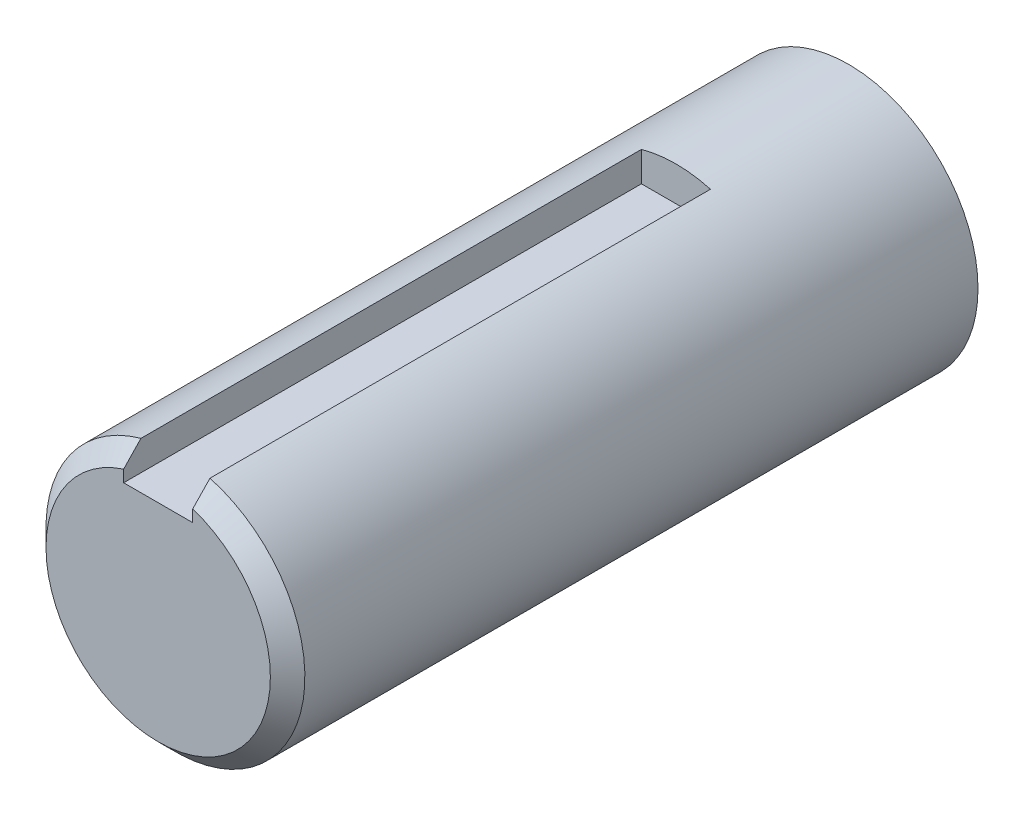
from build123d import *

# Parameters (mm, degrees)
SKETCH1_R           = 15
BOSS_EXTRUDE1_DEPTH = 40
CUT_EXTRUDE1_DEPTH  = 60
CHAMFER1_SIZE       = 2


with BuildPart() as part:
    # Sketch1 → Boss-Extrude1 (new, symmetric)
    with BuildSketch(Plane.XY):
        Circle(SKETCH1_R)
    extrude(amount=BOSS_EXTRUDE1_DEPTH, both=True)

    # Sketch2 → Cut-Extrude1 (cut)
    with BuildSketch(Plane.XY.offset(40)):
        with BuildLine():
            Line((-4, 14.456832295), (-4, 11))
            Line((-4, 11), (4, 11))
            Line((4, 11), (4, 14.456832295))
            ThreePointArc((4, 14.456832295), (0, 15), (-4, 14.456832295))
        make_face()
    extrude(amount=-CUT_EXTRUDE1_DEPTH, mode=Mode.SUBTRACT)

    # Chamfer1
    chamfer1_edges = [part.edges().sort_by_distance(p)[0] for p in [
        (-9.082951062, -11.937336386, 40),
    ]]
    chamfer(chamfer1_edges, length=CHAMFER1_SIZE)


solid = part.part
